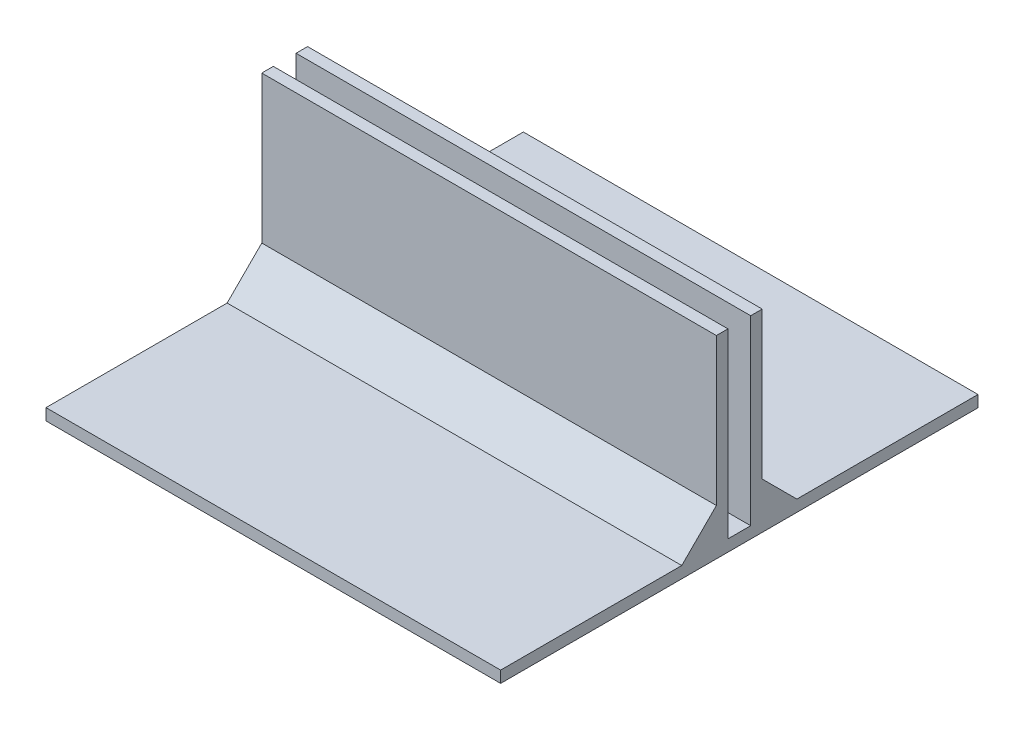
from build123d import *

# Parameters (mm, degrees)
SKETCH1_W           = 100
SKETCH1_H           = 105
BOSS_EXTRUDE1_DEPTH = 2.54
SKETCH2_W           = 100
SKETCH2_H           = 2.54
BOSS_EXTRUDE2_DEPTH = 40
CHAMFER1_SIZE       = 7.62


with BuildPart() as part:
    # Sketch1 → Boss-Extrude1 (new body)
    with BuildSketch(Plane(origin=(0, 0, 0), x_dir=(1, 0, 0), z_dir=(0, 1, 0))):
        Rectangle(SKETCH1_W, SKETCH1_H)
    extrude(amount=BOSS_EXTRUDE1_DEPTH)

    # Sketch2 → Boss-Extrude2 (add)
    with BuildSketch(Plane(origin=(0, 2.54, 0), x_dir=(1, 0, 0), z_dir=(0, 1, 0))):
        with Locations((0, 3.77)):
            Rectangle(SKETCH2_W, SKETCH2_H)
        with Locations((0, -3.77)):
            Rectangle(SKETCH2_W, SKETCH2_H)
    extrude(amount=BOSS_EXTRUDE2_DEPTH)

    # Chamfer1
    chamfer1_edges = [part.edges().sort_by_distance(p)[0] for p in [
        (0, 2.54, -5.04),
        (0, 2.54, 5.04),
    ]]
    chamfer(chamfer1_edges, length=CHAMFER1_SIZE)


solid = part.part
